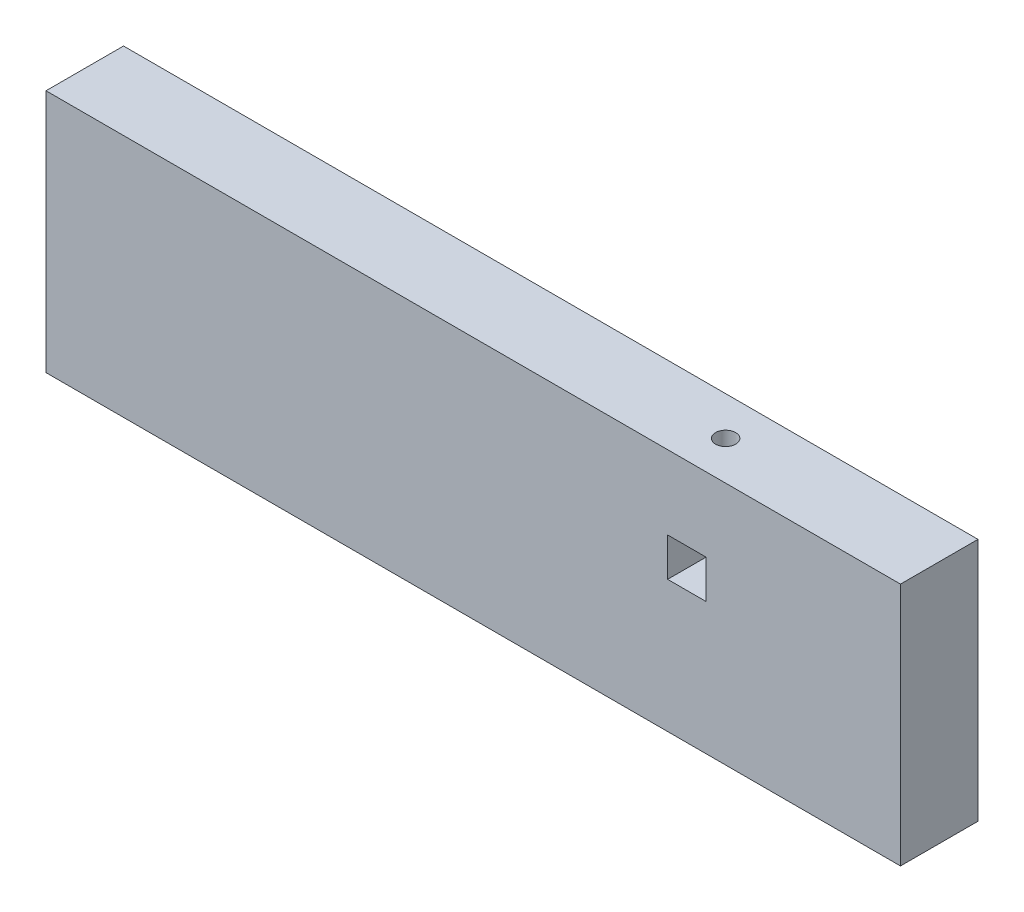
from build123d import *

# Parameters (mm, degrees)
SKETCH1_W                       = 140
SKETCH1_H                       = 40
SKETCH1_W_2                     = 6.3
SKETCH1_H_2                     = 6.3
BOSS_EXTRUDE1_DEPTH             = 12.7
TAP_DRILL_FOR_M4X0_7_TAP1_D     = 3.3
TAP_DRILL_FOR_M4X0_7_TAP1_DEPTH = 12.1
TAP_DRILL_FOR_M5X0_8_TAP2_D     = 4.2
TAP_DRILL_FOR_M5X0_8_TAP2_DEPTH = 7
TAP_DRILL_FOR_M5X0_8_TAP2_TIP   = 1.2618073


with BuildPart() as part:
    # Sketch1 → Boss-Extrude1 (new body)
    with BuildSketch(Plane.XY):
        with Locations((0, 20)):
            Rectangle(SKETCH1_W, SKETCH1_H)
        with Locations((35, 24.75)):
            Rectangle(SKETCH1_W_2, SKETCH1_H_2, mode=Mode.SUBTRACT)
    extrude(amount=BOSS_EXTRUDE1_DEPTH)

    # Tap Drill for M4x0.7 Tap1
    with Locations(Plane(origin=(35, 40, 6.35), x_dir=(0, 0, 1), z_dir=(0, 1, 0))):
        with Locations((0, 0)):
            Hole(TAP_DRILL_FOR_M4X0_7_TAP1_D / 2, depth=TAP_DRILL_FOR_M4X0_7_TAP1_DEPTH)

    # Tap Drill for M5x0.8 Tap2
    with Locations(Plane(origin=(-60, 0, 6.35), x_dir=(0, 0, -1), z_dir=(0, -1, 0))):
        with Locations((0, 0), (0, 60), (0, 120)):
            Hole(TAP_DRILL_FOR_M5X0_8_TAP2_D / 2, depth=TAP_DRILL_FOR_M5X0_8_TAP2_DEPTH)
            with Locations((0, 0, -(TAP_DRILL_FOR_M5X0_8_TAP2_DEPTH + TAP_DRILL_FOR_M5X0_8_TAP2_TIP / 2))):  # 118° drill point
                Cone(0, TAP_DRILL_FOR_M5X0_8_TAP2_D / 2, TAP_DRILL_FOR_M5X0_8_TAP2_TIP, mode=Mode.SUBTRACT)


solid = part.part
